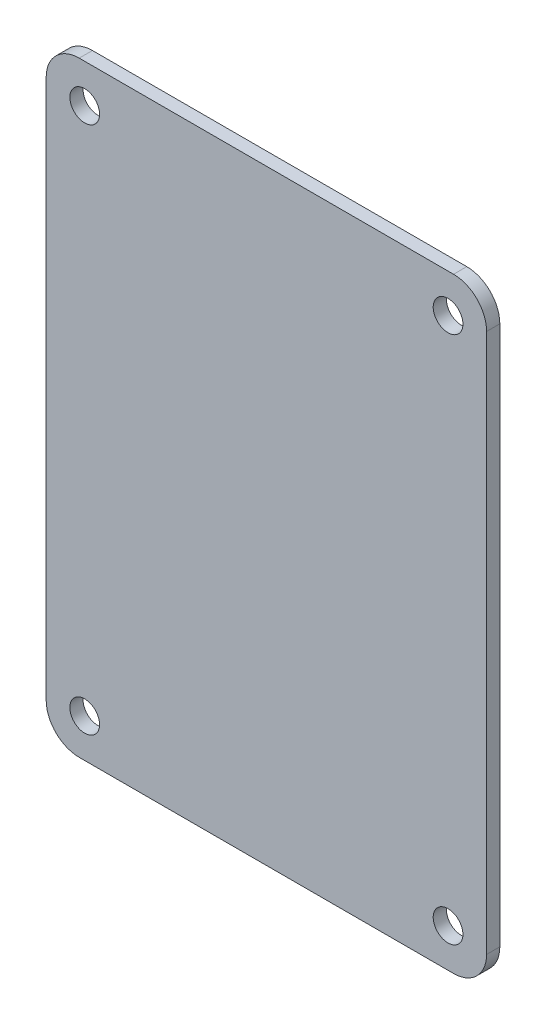
from build123d import *

# Parameters (mm, degrees)
SKETCH1_R           = 1.35
BOSS_EXTRUDE1_DEPTH = 0.6


with BuildPart() as part:
    # Sketch1 → Boss-Extrude1 (new, symmetric)
    with BuildSketch(Plane.XY):
        with BuildLine():
            Line((-17, -27.5), (17, -27.5))
            ThreePointArc((17, -27.5), (19.121320344, -26.621320344), (20, -24.5))
            Line((20, -24.5), (20, 24.5))
            ThreePointArc((20, 24.5), (19.121320344, 26.621320344), (17, 27.5))
            Line((17, 27.5), (-17, 27.5))
            ThreePointArc((-17, 27.5), (-19.121320344, 26.621320344), (-20, 24.5))
            Line((-20, 24.5), (-20, -24.5))
            ThreePointArc((-20, -24.5), (-19.121320344, -26.621320344), (-17, -27.5))
        make_face()
        with Locations((-16.5, 24)):
            Circle(SKETCH1_R, mode=Mode.SUBTRACT)
        with Locations((-16.5, -24)):
            Circle(SKETCH1_R, mode=Mode.SUBTRACT)
        with Locations((16.5, -24)):
            Circle(SKETCH1_R, mode=Mode.SUBTRACT)
        with Locations((16.5, 24)):
            Circle(SKETCH1_R, mode=Mode.SUBTRACT)
    extrude(amount=BOSS_EXTRUDE1_DEPTH, both=True)


solid = part.part
